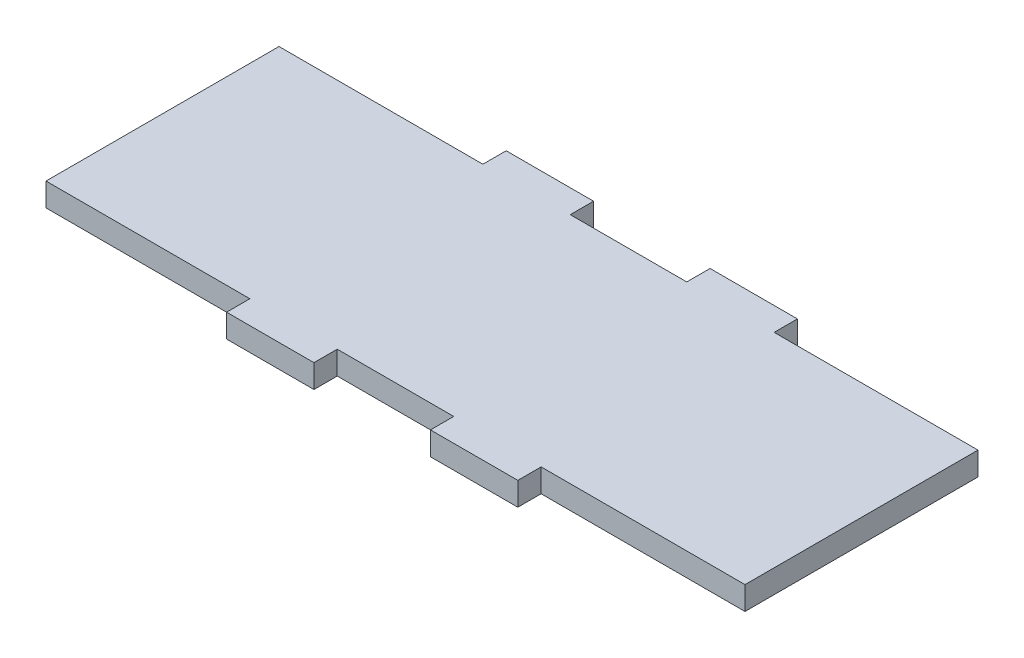
from build123d import *

# Parameters (mm, degrees)
SKETCH1_W           = 120
SKETCH1_H           = 4
BOSS_EXTRUDE1_DEPTH = 48
SKETCH2_W           = 35
SKETCH2_H           = 4
SKETCH2_W_2         = 20
CUT_EXTRUDE1_DEPTH  = 48


with BuildPart() as part:
    # Sketch1 → Boss-Extrude1 (new body)
    with BuildSketch(Plane.XY):
        Rectangle(SKETCH1_W, SKETCH1_H)
    extrude(amount=BOSS_EXTRUDE1_DEPTH)

    # Sketch2 → Cut-Extrude1 (cut)
    with BuildSketch(Plane.XZ.offset(2)):
        with Locations((-42.5, 46)):
            Rectangle(SKETCH2_W, SKETCH2_H)
        with Locations((0, 46)):
            Rectangle(SKETCH2_W_2, SKETCH2_H)
        with Locations((42.5, 46)):
            Rectangle(SKETCH2_W, SKETCH2_H)
        with Locations((42.5, 2)):
            Rectangle(SKETCH2_W, SKETCH2_H)
        with Locations((0, 2)):
            Rectangle(SKETCH2_W_2, SKETCH2_H)
        with Locations((-42.5, 2)):
            Rectangle(SKETCH2_W, SKETCH2_H)
    extrude(amount=-CUT_EXTRUDE1_DEPTH, mode=Mode.SUBTRACT)


solid = part.part
